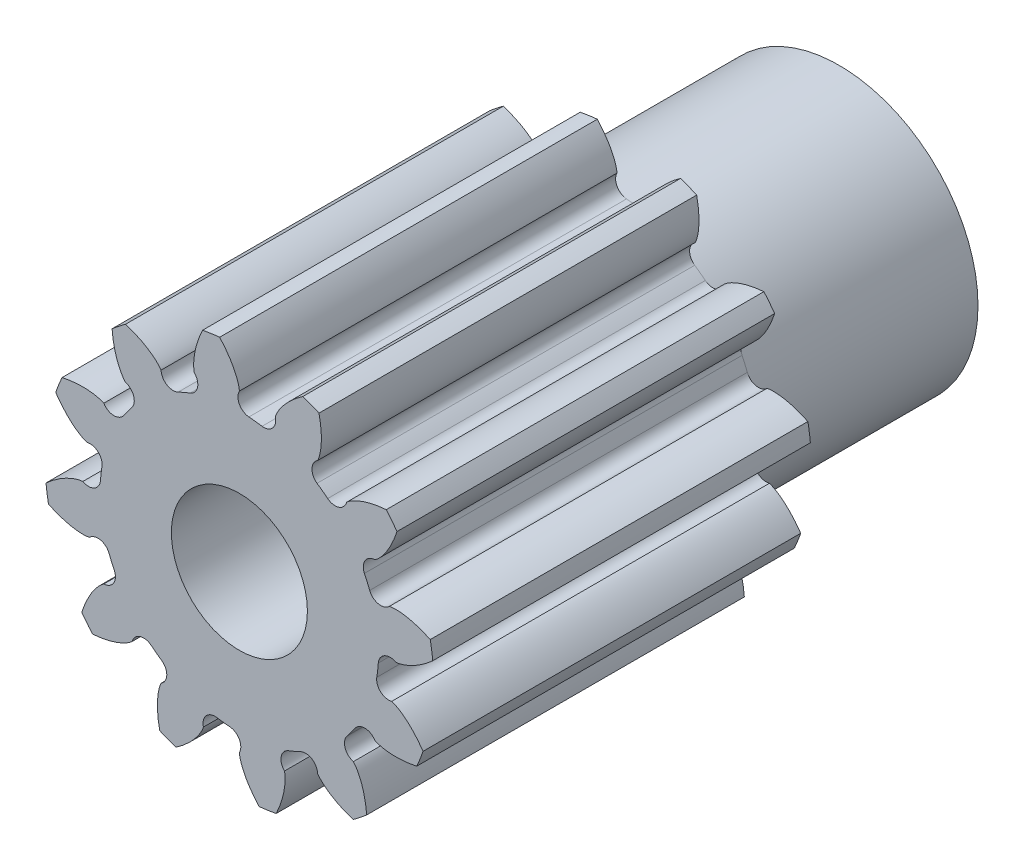
from build123d import *
from build123d.topology import SkipClean

# Parameters (mm, degrees)
BOSS_EXTRUDE1_DEPTH = 6.8
BOSS_EXTRUDE2_DEPTH = 6.8
CIRPATTERN1_COUNT   = 12
SKETCH4_R           = 1.225
CUT_EXTRUDE1_DEPTH  = 6.8
SKETCH5_R           = 2.5
SKETCH5_R_2         = 1.225
BOSS_EXTRUDE3_DEPTH = 4


with BuildPart() as part:
    # Sketch3 → Boss-Extrude1 (new body)
    with BuildSketch(Plane.XY):
        with BuildLine():
            ThreePointArc((2.346090248, 0.883936559), (-2.48041169, -0.364748048), (2.501239263, -0.171129897))
            ThreePointArc((2.501239263, -0.171129897), (2.50562435, -0.085614884), (2.507086614, 0))
            ThreePointArc((2.507086614, 0), (2.466509147, 0.449239266), (2.346090248, 0.883936559))
        make_face()
    extrude(amount=BOSS_EXTRUDE1_DEPTH)

    # Sketch3<3> → Boss-Extrude2 (add)
    with BuildSketch(Plane.XY):
        with BuildLine():
            add(Edge.make_bspline(
                [(2.819077862, 0), (2.822684457, 5.9934e-05), (2.829494906, 0.000520403), (2.840584543, 0.001646652), (2.86238491, 0.00482705), (2.886874693, 0.009726454), (2.914339416, 0.016539491), (2.943623696, 0.02513316), (2.968499699, 0.033266041), (2.9931482, 0.042105391), (3.017541607, 0.051563313), (3.046883591, 0.063785169), (3.081769933, 0.079501269), (3.122069355, 0.099399146), (3.167178041, 0.123757515), (3.212452591, 0.150468694), (3.25640874, 0.178293885), (3.300080528, 0.208147221), (3.341806586, 0.238263361), (3.384320757, 0.271284627), (3.422935597, 0.302482694), (3.454575541, 0.330020163), (3.472867449, 0.346205207), (3.482005859, 0.354450554)],
                knots=[0, 0, 0, 0, 0, 0.015083688, 0.02853182, 0.046610139, 0.092110525, 0.119476176, 0.146842496, 0.174208854, 0.201574956, 0.228941013, 0.256307345, 0.307035032, 0.361767352, 0.416499661, 0.471231936, 0.525964282, 0.580696615, 0.635428982, 0.690161387, 0.744893688, 0.798428695, 0.798428695, 0.798428695, 0.798428695, 0.798428695], degree=4))
            ThreePointArc((3.482005859, 0.354450554), (3.462760667, 0.509203855), (3.436641127, 0.662946274))
            add(Edge.make_bspline(
                [(2.699738327, 0.811549728), (2.703209497, 0.81253059), (2.709864199, 0.81405019), (2.720808603, 0.816164078), (2.742601665, 0.819394155), (2.767465155, 0.82175222), (2.79572854, 0.82313408), (2.82624706, 0.823334498), (2.852411267, 0.822707152), (2.878560979, 0.821337751), (2.904644469, 0.819302528), (2.936262724, 0.816044961), (2.974196544, 0.81103717), (3.018518133, 0.803582931), (3.068729473, 0.793241508), (3.119776977, 0.780694622), (3.16988259, 0.766701347), (3.220299738, 0.750683922), (3.26892918, 0.733854686), (3.319149693, 0.714470186), (3.365111087, 0.695709174), (3.403339047, 0.678445879), (3.42551592, 0.668211827), (3.436641127, 0.662946274)],
                knots=[0, 0, 0, 0, 0, 0.015083688, 0.02853182, 0.046610139, 0.092110525, 0.119476176, 0.146842496, 0.174208854, 0.201574956, 0.228941013, 0.256307345, 0.307035032, 0.361767352, 0.416499661, 0.471231936, 0.525964282, 0.580696615, 0.635428982, 0.690161387, 0.744893688, 0.798428695, 0.798428695, 0.798428695, 0.798428695, 0.798428695], degree=4))
            ThreePointArc((2.699738327, 0.811549728), (2.50347088, 0.752751784), (2.346090248, 0.883936559))
            ThreePointArc((2.346090248, 0.883936559), (2.466509147, 0.449239266), (2.507086614, 0))
            ThreePointArc((2.507086614, 0), (2.50562435, -0.085614884), (2.501239263, -0.171129897))
            ThreePointArc((2.501239263, -0.171129897), (2.614192353, -0.000192165), (2.819077862, 0))
        make_face()
    boss_extrude2 = extrude(amount=BOSS_EXTRUDE2_DEPTH)

    # CirPattern1: Boss-Extrude2 ×12 about axis
    cirpattern1_axis = Axis((0, 0, 6.8), (0, 0, -1))
    for i in range(1, CIRPATTERN1_COUNT):
        add(boss_extrude2.rotate(cirpattern1_axis, i * 360 / CIRPATTERN1_COUNT))

    # Sketch4 → Cut-Extrude1 (cut)
    with BuildSketch(Plane.XY.offset(6.8)):
        Circle(SKETCH4_R)
    extrude(amount=-CUT_EXTRUDE1_DEPTH, mode=Mode.SUBTRACT)

    # Sketch5 → Boss-Extrude3 (add)
    with SkipClean():  # the faces are left unmerged after this step: merging them gives an invalid solid
        with BuildSketch(Plane(origin=(0, 0, 0), x_dir=(-1, 0, 0), z_dir=(0, 0, -1))):
            Circle(SKETCH5_R)
            Circle(SKETCH5_R_2, mode=Mode.SUBTRACT)
        extrude(amount=BOSS_EXTRUDE3_DEPTH)
    add(part.part.scale(1), mode=Mode.REPLACE)  # the faces are merged on a copy


solid = part.part
